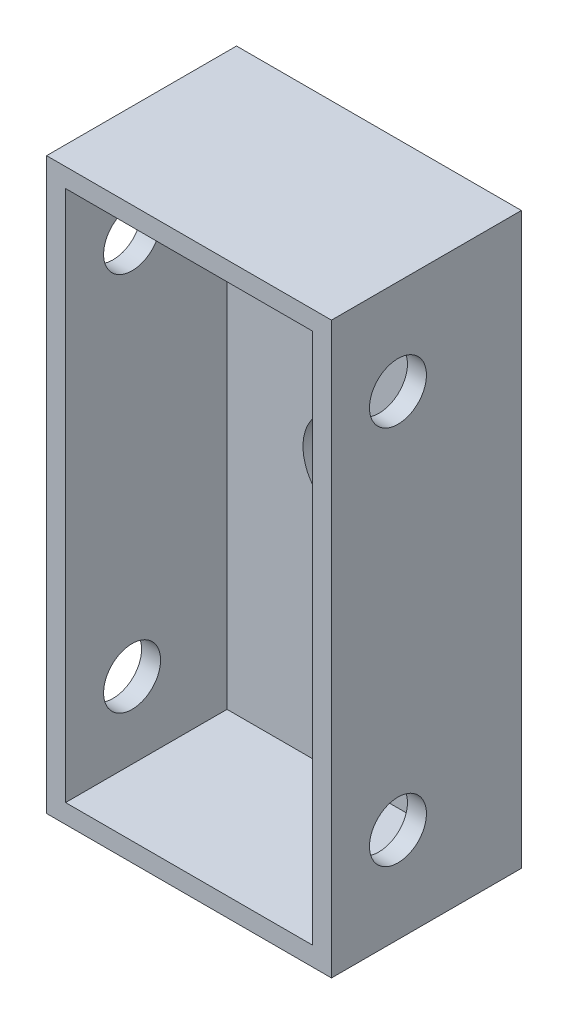
from build123d import *

# Parameters (mm, degrees)
ESBO_O1_W                = 30
ESBO_O1_H                = 60
RESSALTO_EXTRUS_O1_DEPTH = 20
CORTE_EXTRUS_O1_DEPTH    = 17
ESBO_O7_R                = 3
ESBO_O7_R_2              = 5
CORTE_EXTRUS_O2_DEPTH    = 17
ESBO_O9_R                = 3
CORTE_EXTRUS_O4_DEPTH    = 71


with BuildPart() as part:
    # Esboço1 → Ressalto-extrusão1 (new body)
    with BuildSketch(Plane.XY):
        with Locations((15, 30)):
            Rectangle(ESBO_O1_W, ESBO_O1_H)
    extrude(amount=RESSALTO_EXTRUS_O1_DEPTH)

    # Esboço6 → Corte-extrusão1 (cut)
    with BuildSketch(Plane.XY.offset(20)):
        Polygon((28, 58), (15, 58), (2, 58), (2, 2), (15, 2), (28, 2), align=None)
    extrude(amount=-CORTE_EXTRUS_O1_DEPTH, mode=Mode.SUBTRACT)

    # Esboço7 → Corte-extrusão2 (cut)
    with BuildSketch(Plane.XY.offset(3)):
        with Locations((15, 10)):
            Circle(ESBO_O7_R)
        with Locations((15, 50)):
            Circle(ESBO_O7_R)
        with Locations((15, 30)):
            Circle(ESBO_O7_R_2)
    extrude(amount=-CORTE_EXTRUS_O2_DEPTH, mode=Mode.SUBTRACT)

    # Esboço9 → Corte-extrusão4 (cut, through all)
    with BuildSketch(Plane(origin=(30, 0, 0), x_dir=(0, 0, -1), z_dir=(1, 0, 0))):
        with Locations((-13, 50)):
            Circle(ESBO_O9_R)
        with Locations((-13, 10)):
            Circle(ESBO_O9_R)
    extrude(amount=-CORTE_EXTRUS_O4_DEPTH, mode=Mode.SUBTRACT)


solid = part.part
